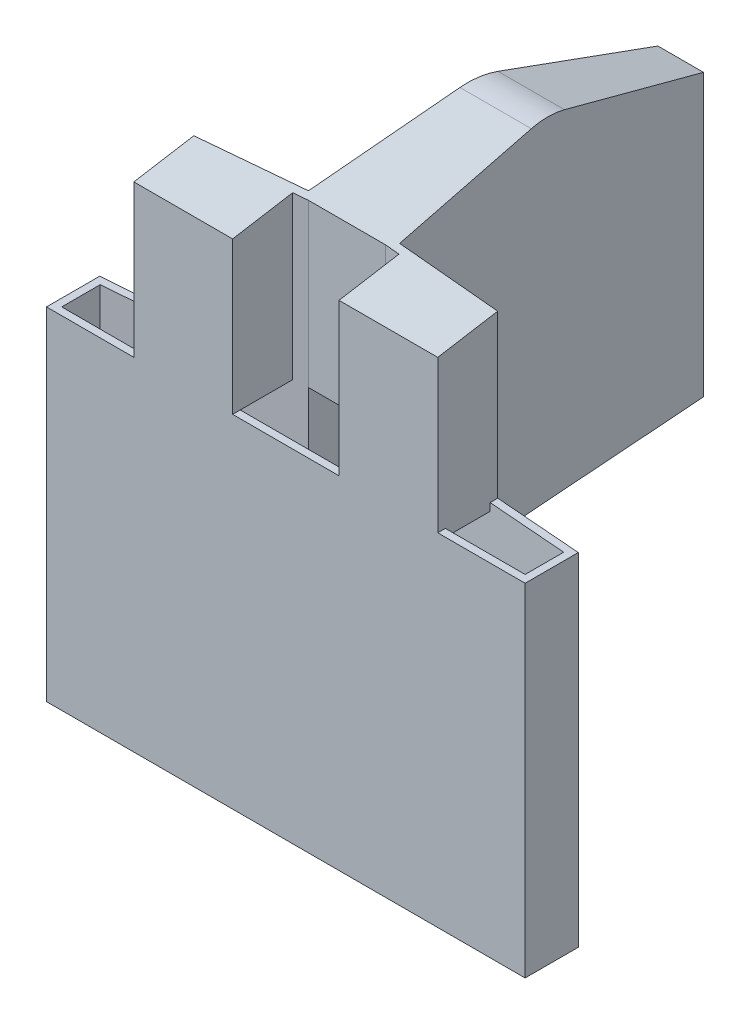
from build123d import *

# Parameters (mm, degrees)
BOSS_EXTRUDE1_DEPTH     = 70
CUT_EXTRUDE1_DEPTH      = 25
CUT_EXTRUDE4_DEPTH      = 24
CUT_EXTRUDE4_DEPTH_BACK = 27
SHELL2_T                = -1
FILLET1_R               = 10
CUT_EXTRUDE3_DEPTH      = 26
CUT_EXTRUDE2_DEPTH      = 1
BOSS_EXTRUDE4_DEPTH     = 21.5
BOSS_EXTRUDE5_DEPTH     = 22
CUT_EXTRUDE8_DEPTH      = 20
CUT_EXTRUDE10_DEPTH     = 34


with BuildPart() as part:
    # Sketch2 → Boss-Extrude1 (new body)
    with BuildSketch(Plane(origin=(0, 0, 0), x_dir=(1, 0, 0), z_dir=(0, 1, 0))):
        Polygon((-18.988562983, 28.382917999), (-4.988562983, 29.470238095), (-1.988562983, 72.470238095), (4.011437017, 72.470238095), (7.011437017, 29.470238095), (32.511437017, 27.489762205), (32.511437017, 20.489762205), (-30.488562983, 20.489762205), (-30.488562983, 27.489762205), align=None)
    extrude(amount=BOSS_EXTRUDE1_DEPTH)

    # Sketch3 → Cut-Extrude1 (cut)
    with BuildSketch(Plane(origin=(0, 70, 0), x_dir=(1, 0, 0), z_dir=(0, 1, 0))):
        Polygon((-30.488562983, 27.489762205), (-30.488562983, 20.489762205), (-18.988562983, 20.489762205), (-18.988562983, 28.382917999), align=None)
        Polygon((21.011437017, 20.489762205), (32.511437017, 20.489762205), (32.511437017, 27.489762205), (21.011437017, 28.382917999), align=None)
    extrude(amount=-CUT_EXTRUDE1_DEPTH, mode=Mode.SUBTRACT)

    # Sketch7 → Cut-Extrude4 (cut, two sides: drawn at the far end of the back side and taken through both)
    with BuildSketch(Plane(origin=(0, 0, 0), x_dir=(0, 0, -1), z_dir=(1, 0, 0)).offset(-CUT_EXTRUDE4_DEPTH_BACK)):
        Polygon((20.489762205, 65), (50.489762205, 70), (20.489762205, 70), align=None)
        Polygon((72.470238095, 63), (50.489762205, 70), (72.470238095, 70), align=None)
    extrude(amount=CUT_EXTRUDE4_DEPTH + CUT_EXTRUDE4_DEPTH_BACK, mode=Mode.SUBTRACT)

    # Shell2
    shell2_openings = [part.faces().sort_by_distance(p)[0] for p in [
        (1.011437017, 0, -34.888692943),
    ]]
    offset(amount=SHELL2_T, openings=shell2_openings, kind=Kind.INTERSECTION)

    # Fillet1
    fillet1_edges = [part.edges().sort_by_distance(p)[0] for p in [
        (1.011437017, 70, -50.489762205),
    ]]
    fillet(fillet1_edges, radius=FILLET1_R)

    # Sketch6 → Cut-Extrude3 (cut)
    with BuildSketch(Plane.XZ):
        Polygon((-4.988562983, -29.470238095), (7.011437017, -29.470238095), (4.011437017, -72.470238095), (-1.988562983, -72.470238095), align=None)
    extrude(amount=-CUT_EXTRUDE3_DEPTH, mode=Mode.SUBTRACT)

    # Sketch4 → Cut-Extrude2 (cut)
    with BuildSketch(Plane(origin=(0, 45, 0), x_dir=(1, 0, 0), z_dir=(0, 1, 0))):
        Polygon((31.511437017, 21.489762205), (21.011437017, 21.489762205), (21.011437017, 27.379906551), (31.511437017, 26.564416479), align=None)
        Polygon((-29.488562983, 21.489762205), (-29.488562983, 26.564416479), (-18.988562983, 27.379906551), (-18.988562983, 21.489762205), align=None)
    extrude(amount=-CUT_EXTRUDE2_DEPTH, mode=Mode.SUBTRACT)

    # Sketch16 → Boss-Extrude4 (add)
    with BuildSketch(Plane(origin=(0, 45, 0), x_dir=(-1, 0, 0), z_dir=(0, -1, 0))):
        Polygon((-6.009006224, 29.470238095), (3.986132189, 29.470238095), (4.051029671, 28.540040848), (-6.073903706, 28.540040848), align=None)
    extrude(amount=-BOSS_EXTRUDE4_DEPTH)

    # Sketch19 → Boss-Extrude5 (add)
    with BuildSketch(Plane(origin=(0, 45, 0), x_dir=(-1, 0, 0), z_dir=(0, -1, 0))):
        Polygon((5.988562983, 28.389560926), (5.988562983, 21.489762205), (6.988562983, 21.489762205), (6.988562983, 28.311895205), align=None)
        Polygon((-8.011437017, 21.489762205), (-8.011437017, 28.389560926), (-9.011437017, 28.311895205), (-9.011437017, 21.489762205), align=None)
    extrude(amount=-BOSS_EXTRUDE5_DEPTH)

    # Sketch20 → Cut-Extrude8 (cut, symmetric)
    with BuildSketch(Plane(origin=(-5.988562983, 0, 0), x_dir=(0, 0, -1), z_dir=(1, 0, 0))):
        Polygon((21.489762205, 67), (21.489762205, 65.166666667), (30.609777223, 66.68666917), (30.609777223, 67), align=None)
    extrude(amount=CUT_EXTRUDE8_DEPTH, both=True, mode=Mode.SUBTRACT)

    # Sketch22 → Cut-Extrude10 (cut)
    with BuildSketch(Plane(origin=(0, 45, 0), x_dir=(-1, 0, 0), z_dir=(0, -1, 0))):
        Polygon((-8.011437017, 28.389560926), (-8.011437017, 20.489762205), (5.988562983, 20.489762205), (5.988562983, 28.389560926), (4.051029671, 28.540040848), (-6.073903706, 28.540040848), align=None)
    extrude(amount=-CUT_EXTRUDE10_DEPTH, mode=Mode.SUBTRACT)


solid = part.part
